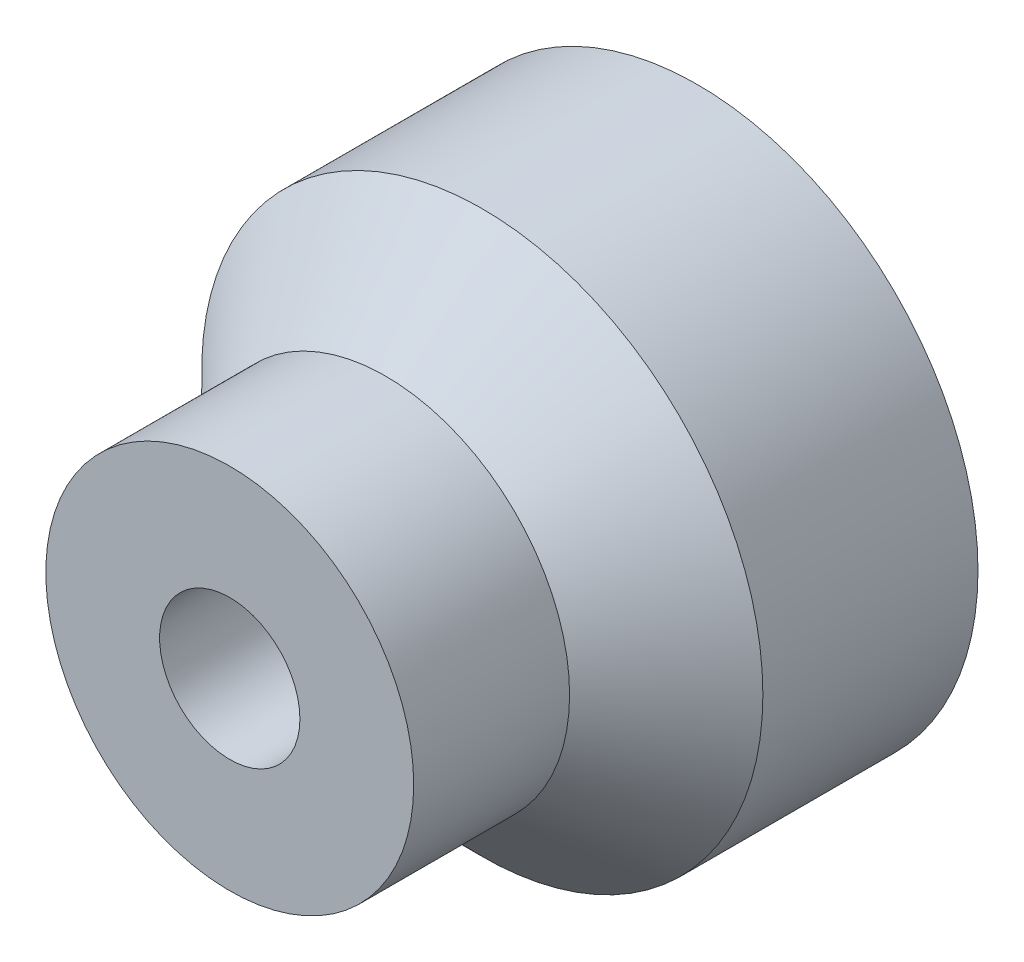
from build123d import *


with BuildPart() as part:
    # Sketch1 → Revolve1 (revolve)
    with BuildSketch(Plane(origin=(0, 0, 0), x_dir=(1, 0, 0), z_dir=(0, 1, 0))):
        Polygon((2.25, 0), (5.9, 0), (5.9, 5), (9, 8.1), (9, 15), (6, 15), (6, 10), (2.25, 10), align=None)
    revolve(axis=Axis((0, 0, 0), (0, 0, -1)))


solid = part.part
